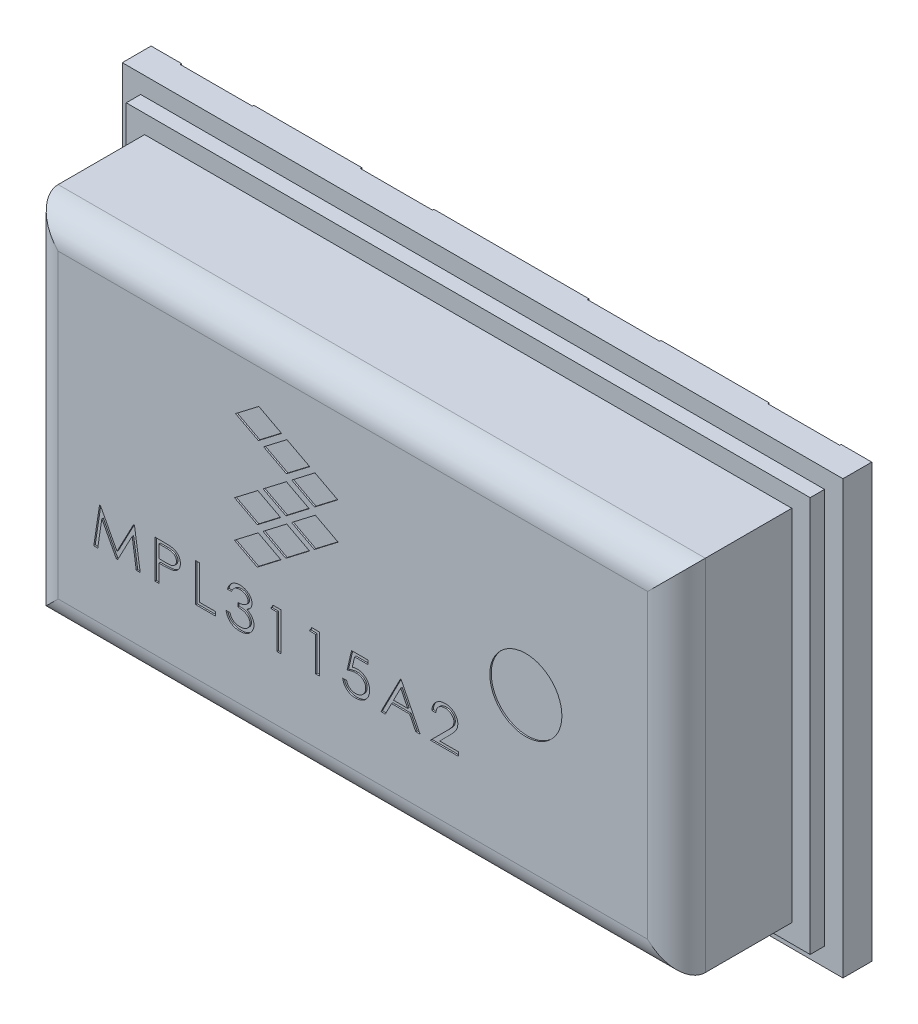
from build123d import *

# Parameters (mm, degrees)
ESQUISSE1_W                = 5
ESQUISSE1_H                = 3
BOSS_EXTRU_1_DEPTH         = 1.1
ESQUISSE2_W                = 5.463986024
ESQUISSE2_H                = 3.314690822
ESQUISSE2_W_2              = 4.49
ESQUISSE2_H_2              = 2.49
ENL_V_MAT_EXTRU_1_DEPTH    = 0.8
ESQUISSE3_W                = 6.113321587
ESQUISSE3_H                = 3.858847251
ESQUISSE3_W_2              = 4.745
ESQUISSE3_H_2              = 2.745
ENL_V_MAT_EXTRU_2_DEPTH    = 0.1
CONG_1_R                   = 0.2
ESQUISSE4_R                = 0.25
ENL_V_MAT_EXTRU_3_DEPTH    = 0.01
ENL_V_MAT_EXTRU_4_DEPTH    = 0.01
R_P_TITION_LIN_AIRE5_COUNT = 3
R_P_TITION_LIN_AIRE5_PITCH = 0.22
R_P_TITION_LIN_AIRE6_COUNT = 3
R_P_TITION_LIN_AIRE6_PITCH = 0.25
ENL_V_MAT_EXTRU_6_DEPTH    = 0.01
R_P_TITION_LIN_AIRE7_COUNT = 3
R_P_TITION_LIN_AIRE7_PITCH = 0.25
ESQUISSE11_W               = 0.5
ESQUISSE11_H               = 0.8
ENL_V_MAT_EXTRU_7_DEPTH    = 0.01


with BuildPart() as part:
    # Esquisse1 → Boss.-Extru.1 (new body)
    with BuildSketch(Plane.XY):
        Rectangle(ESQUISSE1_W, ESQUISSE1_H)
    extrude(amount=BOSS_EXTRU_1_DEPTH)

    # Esquisse2 → Enlèv. mat.-Extru.1 (cut)
    with BuildSketch(Plane.XY.offset(1.1)):
        with Locations((-0.041855809, -0.006906267)):
            Rectangle(ESQUISSE2_W, ESQUISSE2_H)
        Rectangle(ESQUISSE2_W_2, ESQUISSE2_H_2, mode=Mode.SUBTRACT)
    extrude(amount=-ENL_V_MAT_EXTRU_1_DEPTH, mode=Mode.SUBTRACT)

    # Esquisse3 → Enlèv. mat.-Extru.2 (cut)
    with BuildSketch(Plane.XY.offset(0.3)):
        with Locations((-0.001557514, -0.062098825)):
            Rectangle(ESQUISSE3_W, ESQUISSE3_H)
        Rectangle(ESQUISSE3_W_2, ESQUISSE3_H_2, mode=Mode.SUBTRACT)
    extrude(amount=-ENL_V_MAT_EXTRU_2_DEPTH, mode=Mode.SUBTRACT)

    # Congé1
    cong_1_edges = [part.edges().sort_by_distance(p)[0] for p in [
        (0, -1.245, 1.1),
        (-2.245, 0, 1.1),
        (0, 1.245, 1.1),
        (2.245, 0, 1.1),
    ]]
    fillet(cong_1_edges, radius=CONG_1_R)

    # Esquisse4 → Enlèv. mat.-Extru.3 (cut)
    # profile 1 of 10: a face of its own
    with BuildSketch(Plane.XY.offset(1.1)):
        with Locations((1.2, 0)):
            Circle(ESQUISSE4_R)
    # profile 2 of 10: a face of its own
    with BuildSketch(Plane.XY.offset(1.1)):
        Polygon((-1.797798583, -0.601831467), (-1.75799448, -0.337248134), (-1.751369296, -0.337248134), (-1.636674117, -0.554342151), (-1.522137943, -0.337248134), (-1.515459758, -0.337248134), (-1.475549651, -0.601831467), (-1.502845408, -0.601831467), (-1.531519203, -0.411874202), (-1.631691979, -0.601831467), (-1.641444249, -0.601831467), (-1.741829032, -0.411874202), (-1.770396824, -0.601831467), align=None)
    # profile 3 of 10: a face of its own
    with BuildSketch(Plane.XY.offset(1.1)):
        with BuildLine():
            Line((-1.373108412, -0.337248134), (-1.316873853, -0.337248134))
            add(Edge.make_bspline(
                [(-1.316873853, -0.337248134), (-1.3130046, -0.337251925), (-1.305601112, -0.337259178), (-1.294982671, -0.337488225), (-1.285352454, -0.337790167), (-1.276694885, -0.338217738), (-1.269019689, -0.338707253), (-1.26234247, -0.339413279), (-1.256633218, -0.340143325), (-1.253197795, -0.340884702), (-1.251629045, -0.341223244)],
                knots=[0, 0, 0, 0, 1.418409831, 2.714006813, 3.893404716, 4.950375869, 5.891726568, 6.712121466, 7.411903736, 8, 8, 8, 8], degree=3))
            add(Edge.make_bspline(
                [(-1.251629045, -0.341223244), (-1.249641242, -0.341722051), (-1.245728663, -0.34270385), (-1.240083872, -0.344697394), (-1.234711534, -0.347025506), (-1.229608893, -0.349739154), (-1.224774794, -0.352804629), (-1.220248833, -0.356278647), (-1.215997178, -0.360107791), (-1.212030097, -0.364277515), (-1.208426322, -0.368765797), (-1.205264653, -0.37356569), (-1.202641967, -0.378660228), (-1.200400291, -0.38401101), (-1.198827903, -0.389687061), (-1.197553794, -0.395607612), (-1.196897387, -0.401824628), (-1.196779529, -0.406060475), (-1.196719523, -0.408217101)],
                knots=[0, 0, 0, 0, 1.044614879, 2.05610904, 3.048648156, 4.028015397, 5.000229019, 5.96426823, 6.933932136, 7.915327783, 8.896020172, 9.865558509, 10.840731438, 11.814446678, 12.818086411, 13.839363335, 14.899940407, 16, 16, 16, 16], degree=3))
            add(Edge.make_bspline(
                [(-1.196719523, -0.408217101), (-1.196747747, -0.41039286), (-1.196802996, -0.414651907), (-1.197603517, -0.420883198), (-1.198728552, -0.42683236), (-1.200391276, -0.432489355), (-1.202499861, -0.437857794), (-1.205126142, -0.442926068), (-1.208194553, -0.447715625), (-1.211768459, -0.452154112), (-1.215701558, -0.456304534), (-1.219998139, -0.460133147), (-1.224684125, -0.463588348), (-1.229729069, -0.466658186), (-1.235124966, -0.469367651), (-1.240856021, -0.471761708), (-1.246975476, -0.473776664), (-1.251215243, -0.474831734), (-1.253378094, -0.475369962)],
                knots=[0, 0, 0, 0, 1.088161205, 2.130074408, 3.139321425, 4.115850349, 5.076395988, 6.021556806, 6.968288003, 7.918357923, 8.869044838, 9.827308699, 10.794667379, 11.778852344, 12.779307233, 13.813840501, 14.884765, 16, 16, 16, 16], degree=3))
            add(Edge.make_bspline(
                [(-1.253378094, -0.475369962), (-1.255159605, -0.475722257), (-1.259059213, -0.476493406), (-1.265482287, -0.477360927), (-1.272943175, -0.478089083), (-1.281464262, -0.478649666), (-1.291023728, -0.479116614), (-1.301642212, -0.479493521), (-1.31330425, -0.479699735), (-1.321431901, -0.479710478), (-1.325672097, -0.479716083)],
                knots=[0, 0, 0, 0, 0.60082097, 1.315155928, 2.143520297, 3.081116683, 4.140582134, 5.31053358, 6.59690521, 8, 8, 8, 8], degree=3))
            Line((-1.325672097, -0.479716083), (-1.34597166, -0.479716083))
            Line((-1.34597166, -0.479716083), (-1.34597166, -0.601831467))
            Line((-1.34597166, -0.601831467), (-1.373108412, -0.601831467))
            Line((-1.373108412, -0.601831467), (-1.373108412, -0.337248134))
        make_face()
        with BuildLine():
            Line((-1.34597166, -0.364384886), (-1.34597166, -0.452579331))
            Line((-1.34597166, -0.452579331), (-1.296945301, -0.453162347))
            add(Edge.make_bspline(
                [(-1.296945301, -0.453162347), (-1.29454218, -0.453163595), (-1.289910946, -0.453166002), (-1.283232555, -0.452865269), (-1.277045261, -0.452516565), (-1.271350149, -0.452003686), (-1.266157975, -0.451297528), (-1.261454264, -0.450550354), (-1.257273768, -0.449515799), (-1.252378318, -0.448097108), (-1.246927845, -0.445697726), (-1.241009962, -0.442179503), (-1.235940501, -0.437752553), (-1.231614451, -0.432710384), (-1.228201742, -0.427109156), (-1.225644032, -0.421144762), (-1.224115281, -0.414830468), (-1.223943092, -0.410504324), (-1.223856275, -0.408323104)],
                knots=[0, 0, 0, 0, 1.187936968, 2.289362064, 3.304418159, 4.251789532, 5.115278311, 5.895009063, 6.604718384, 7.243061292, 8.41291016, 9.537911015, 10.634059128, 11.724519996, 12.810599303, 13.863471255, 14.922772688, 16, 16, 16, 16], degree=3))
            add(Edge.make_bspline(
                [(-1.223856275, -0.408323104), (-1.223943695, -0.406194588), (-1.224117804, -0.401955343), (-1.225655832, -0.395751125), (-1.228197092, -0.389849123), (-1.231636453, -0.384319973), (-1.235839654, -0.379289506), (-1.240793678, -0.375004703), (-1.246345239, -0.371460221), (-1.251543234, -0.369237391), (-1.256158645, -0.367865891), (-1.260152518, -0.366902688), (-1.264667881, -0.366121906), (-1.269694688, -0.365514969), (-1.275224068, -0.364968896), (-1.281270556, -0.364614703), (-1.287845095, -0.364400087), (-1.292404657, -0.364390081), (-1.294772241, -0.364384886)],
                knots=[0, 0, 0, 0, 1.079672715, 2.15032351, 3.223565093, 4.331534505, 5.445842985, 6.539700356, 7.644832641, 8.778158669, 9.396906618, 10.088920543, 10.863330602, 11.722450615, 12.659849889, 13.684592725, 14.7977086, 16, 16, 16, 16], degree=3))
            Line((-1.294772241, -0.364384886), (-1.34597166, -0.364384886))
        make_face(mode=Mode.SUBTRACT)
    # profile 4 of 10: a face of its own
    with BuildSketch(Plane.XY.offset(1.1)):
        Polygon((-1.09088619, -0.337248134), (-1.063749438, -0.337248134), (-1.063749438, -0.574694715), (-0.951810335, -0.574694715), (-0.951810335, -0.601831467), (-1.09088619, -0.601831467), align=None)
    # profile 5 of 10: a face of its own
    with BuildSketch(Plane.XY.offset(1.1)):
        with BuildLine():
            Line((-0.842584908, -0.398305826), (-0.86972166, -0.398305826))
            add(Edge.make_bspline(
                [(-0.86972166, -0.398305826), (-0.869006615, -0.3956417), (-0.86760721, -0.390427776), (-0.86478685, -0.382976449), (-0.861640495, -0.375950976), (-0.857966898, -0.369407738), (-0.853829011, -0.363330436), (-0.849175938, -0.3577628), (-0.844162711, -0.352575024), (-0.838609527, -0.347988286), (-0.832759805, -0.343848355), (-0.826572942, -0.340290912), (-0.820138274, -0.337260648), (-0.813445319, -0.334749326), (-0.806466528, -0.332851529), (-0.799253807, -0.331487859), (-0.791778914, -0.330593257), (-0.786706314, -0.330507565), (-0.784124287, -0.330463946)],
                knots=[0, 0, 0, 0, 1.116355944, 2.184804219, 3.222141051, 4.231113984, 5.219328683, 6.194876446, 7.166217883, 8.136267484, 9.106844572, 10.065215996, 11.022117626, 11.98422021, 12.956167426, 13.946761748, 14.954871942, 16, 16, 16, 16], degree=3))
            add(Edge.make_bspline(
                [(-0.784124287, -0.330463946), (-0.780371292, -0.330568638), (-0.772944587, -0.330775809), (-0.76202922, -0.332650589), (-0.751504679, -0.335623305), (-0.74149577, -0.339738076), (-0.732205694, -0.344821722), (-0.723897707, -0.350819184), (-0.716787704, -0.357747609), (-0.710787417, -0.365343794), (-0.706095421, -0.373493279), (-0.702637747, -0.381874098), (-0.700525403, -0.390481646), (-0.700253125, -0.396298073), (-0.700116959, -0.399206851)],
                knots=[0, 0, 0, 0, 1.123321227, 2.222910833, 3.306649022, 4.393470362, 5.456864647, 6.471880394, 7.452320752, 8.420908763, 9.362108778, 10.259259549, 11.129460877, 12, 12, 12, 12], degree=3))
            add(Edge.make_bspline(
                [(-0.700116959, -0.399206851), (-0.700208754, -0.402007081), (-0.700388791, -0.407499195), (-0.702108251, -0.41549247), (-0.704823686, -0.423040134), (-0.708613704, -0.430168839), (-0.713579838, -0.436778554), (-0.719565438, -0.442970861), (-0.72667745, -0.448667841), (-0.731985917, -0.45194646), (-0.734726918, -0.45363936)],
                knots=[0, 0, 0, 0, 0.989635591, 1.940980818, 2.878257013, 3.820688598, 4.785857322, 5.793802215, 6.860840457, 8, 8, 8, 8], degree=3))
            add(Edge.make_bspline(
                [(-0.734726918, -0.45363936), (-0.731663382, -0.454989961), (-0.725644408, -0.457643507), (-0.717434709, -0.46296832), (-0.709947721, -0.469016012), (-0.705758716, -0.473820266), (-0.703668057, -0.476217986)],
                knots=[0, 0, 0, 0, 1.034096765, 2.031705015, 3.017658317, 4, 4, 4, 4], degree=3))
            add(Edge.make_bspline(
                [(-0.703668057, -0.476217986), (-0.702287164, -0.477957844), (-0.699557927, -0.481396548), (-0.696174344, -0.486962613), (-0.69312006, -0.49257785), (-0.690791466, -0.49843813), (-0.68882182, -0.504384765), (-0.687520215, -0.510535301), (-0.686699142, -0.516829962), (-0.68659893, -0.521090003), (-0.686548583, -0.523230289)],
                knots=[0, 0, 0, 0, 1.043047349, 2.06150724, 3.057059767, 4.044020338, 5.020973223, 5.99827899, 6.994316291, 8, 8, 8, 8], degree=3))
            add(Edge.make_bspline(
                [(-0.686548583, -0.523230289), (-0.686593756, -0.525086732), (-0.686683889, -0.528790855), (-0.687275673, -0.534320512), (-0.688276305, -0.539779925), (-0.68972898, -0.545180017), (-0.691586187, -0.550504223), (-0.693799866, -0.555781277), (-0.696506985, -0.560932868), (-0.699467729, -0.566052129), (-0.702870475, -0.570949959), (-0.706532532, -0.575637524), (-0.710480438, -0.58005286), (-0.714840912, -0.584063863), (-0.719368965, -0.587921526), (-0.724278463, -0.591391661), (-0.729418652, -0.594660222), (-0.734875178, -0.597544951), (-0.740554156, -0.600150447), (-0.7464122, -0.602416809), (-0.752441992, -0.604352119), (-0.758631688, -0.605857536), (-0.764979593, -0.607092841), (-0.771488908, -0.607992632), (-0.778178676, -0.6085375), (-0.782692224, -0.608589425), (-0.784972311, -0.608615655)],
                knots=[0, 0, 0, 0, 0.92169803, 1.839044851, 2.757774576, 3.674827786, 4.612457936, 5.555774093, 6.513016878, 7.499902905, 8.490174619, 9.47107816, 10.452334622, 11.426626846, 12.410467524, 13.403648671, 14.408766131, 15.432992845, 16.465300959, 17.509466555, 18.549756312, 19.60710264, 20.67025462, 21.759431652, 22.868142969, 24, 24, 24, 24], degree=3))
            add(Edge.make_bspline(
                [(-0.784972311, -0.608615655), (-0.788030659, -0.60855108), (-0.794019609, -0.608424628), (-0.802817185, -0.607535485), (-0.811194557, -0.60593403), (-0.819201041, -0.603744707), (-0.826848151, -0.60101881), (-0.834098341, -0.597595439), (-0.840958353, -0.5935673), (-0.847379539, -0.588892637), (-0.853337357, -0.583618044), (-0.858822051, -0.577791209), (-0.863713953, -0.571324768), (-0.868049726, -0.564303304), (-0.871919872, -0.556737041), (-0.875081483, -0.548538239), (-0.877921013, -0.539819187), (-0.879228261, -0.533721325), (-0.879897942, -0.530597493)],
                knots=[0, 0, 0, 0, 1.089030947, 2.132572979, 3.144340947, 4.122636792, 5.085826611, 6.031433048, 6.973369982, 7.914634373, 8.855057411, 9.803109251, 10.759391439, 11.737019511, 12.738643989, 13.780724783, 14.863102731, 16, 16, 16, 16], degree=3))
            Line((-0.879897942, -0.530597493), (-0.85276119, -0.530597493))
            add(Edge.make_bspline(
                [(-0.85276119, -0.530597493), (-0.85210785, -0.532635276), (-0.850836393, -0.536600983), (-0.848676627, -0.542302663), (-0.846248642, -0.547545594), (-0.843579987, -0.552327599), (-0.840778763, -0.556707114), (-0.837748016, -0.560659786), (-0.834486833, -0.564167429), (-0.832093515, -0.566183721), (-0.830924585, -0.567168507)],
                knots=[0, 0, 0, 0, 1.187591516, 2.311159086, 3.381569441, 4.391100686, 5.348474685, 6.26437783, 7.152297666, 8, 8, 8, 8], degree=3))
            add(Edge.make_bspline(
                [(-0.830924585, -0.567168507), (-0.829371654, -0.568310554), (-0.826267689, -0.570593256), (-0.821224991, -0.573517174), (-0.815899138, -0.57602271), (-0.810193813, -0.577960013), (-0.804235368, -0.579572223), (-0.797935491, -0.580654488), (-0.791349554, -0.581379736), (-0.786847092, -0.581445385), (-0.784548299, -0.581478903)],
                knots=[0, 0, 0, 0, 0.934841818, 1.868542889, 2.823608252, 3.786147903, 4.788489089, 5.816032122, 6.884945635, 8, 8, 8, 8], degree=3))
            add(Edge.make_bspline(
                [(-0.784548299, -0.581478903), (-0.781931061, -0.581432626), (-0.776825307, -0.581342348), (-0.769390125, -0.580506948), (-0.762334556, -0.579286767), (-0.755704286, -0.577386373), (-0.749402314, -0.575105225), (-0.743562893, -0.572133497), (-0.738060154, -0.568764084), (-0.733053918, -0.564825936), (-0.728532992, -0.56058302), (-0.724583952, -0.556104007), (-0.721203445, -0.551468964), (-0.718435472, -0.546640597), (-0.716276604, -0.541611887), (-0.714814412, -0.536386747), (-0.713874081, -0.531002197), (-0.713748605, -0.527350624), (-0.713685335, -0.525509352)],
                knots=[0, 0, 0, 0, 1.249364874, 2.437282909, 3.569203944, 4.664369636, 5.726875827, 6.764470109, 7.787556699, 8.80352195, 9.800248248, 10.744722387, 11.650966389, 12.535226244, 13.397106462, 14.257002303, 15.1211095, 16, 16, 16, 16], degree=3))
            add(Edge.make_bspline(
                [(-0.713685335, -0.525509352), (-0.713791782, -0.523042068), (-0.714004508, -0.518111372), (-0.715913271, -0.510884658), (-0.718901856, -0.503898878), (-0.723130477, -0.49731157), (-0.72827959, -0.491196756), (-0.734317174, -0.485789435), (-0.74120202, -0.481249284), (-0.747583315, -0.478157759), (-0.75324495, -0.476068049), (-0.758074165, -0.474633345), (-0.763469093, -0.47345191), (-0.769403318, -0.472324339), (-0.775895726, -0.471395602), (-0.78292993, -0.470598811), (-0.790512578, -0.469963847), (-0.795766036, -0.469684514), (-0.798487686, -0.469539801)],
                knots=[0, 0, 0, 0, 1.042984283, 2.08433108, 3.143128335, 4.249222157, 5.385113909, 6.51878688, 7.668120448, 8.865777362, 9.511886398, 10.22190494, 10.99673624, 11.849106467, 12.778958184, 13.77268577, 14.846099398, 16, 16, 16, 16], degree=3))
            Line((-0.798487686, -0.469539801), (-0.798487686, -0.442403049))
            add(Edge.make_bspline(
                [(-0.798487686, -0.442403049), (-0.79505554, -0.442347421), (-0.788327419, -0.442238372), (-0.778486075, -0.44092081), (-0.769072042, -0.439109263), (-0.760299472, -0.436321209), (-0.752322467, -0.433081651), (-0.745402792, -0.429317936), (-0.739633844, -0.425134348), (-0.735041532, -0.420463422), (-0.731577769, -0.415449519), (-0.7290796, -0.410211647), (-0.727511654, -0.404738624), (-0.727339856, -0.400983694), (-0.727253711, -0.399100848)],
                knots=[0, 0, 0, 0, 1.341656069, 2.630081648, 3.878419675, 5.087257311, 6.224426624, 7.242095775, 8.16131872, 9.001938776, 9.791789743, 10.533744472, 11.264771053, 12, 12, 12, 12], degree=3))
            add(Edge.make_bspline(
                [(-0.727253711, -0.399100848), (-0.727308423, -0.397719681), (-0.72741723, -0.394972921), (-0.72817189, -0.390945693), (-0.729419948, -0.387049048), (-0.731148858, -0.38328783), (-0.733491765, -0.379716126), (-0.736248841, -0.376262552), (-0.739509556, -0.37294949), (-0.743272041, -0.369874942), (-0.7473426, -0.366956531), (-0.751781888, -0.364469208), (-0.756463193, -0.362344159), (-0.761403307, -0.360579499), (-0.766626725, -0.359271615), (-0.772100591, -0.358322112), (-0.777839499, -0.35772779), (-0.781755444, -0.357643633), (-0.783753277, -0.357600698)],
                knots=[0, 0, 0, 0, 0.853648546, 1.697670886, 2.523188139, 3.378302657, 4.247803805, 5.156940784, 6.106885888, 7.11512794, 8.157515917, 9.199274311, 10.255022773, 11.332799812, 12.437414037, 13.579407759, 14.765064121, 16, 16, 16, 16], degree=3))
            add(Edge.make_bspline(
                [(-0.783753277, -0.357600698), (-0.786960208, -0.357703243), (-0.793195032, -0.357902607), (-0.802196601, -0.359723623), (-0.810569402, -0.362551285), (-0.816982583, -0.366000738), (-0.821718104, -0.369388594), (-0.825116206, -0.372322142), (-0.828392408, -0.375642374), (-0.831483213, -0.37941752), (-0.834512532, -0.38354433), (-0.837384122, -0.388075121), (-0.840087771, -0.393025184), (-0.841736936, -0.396512639), (-0.842584908, -0.398305826)],
                knots=[0, 0, 0, 0, 1.509259838, 2.934260404, 4.308252053, 5.660031487, 6.34601821, 7.048371135, 7.772289125, 8.540633061, 9.344706165, 10.182863007, 11.065660648, 12, 12, 12, 12], degree=3))
        make_face()
    # profile 6 of 10: a face of its own
    with BuildSketch(Plane.XY.offset(1.1)):
        Polygon((-0.553737502, -0.337248134), (-0.499304993, -0.337248134), (-0.499304993, -0.601831467), (-0.526441745, -0.601831467), (-0.526441745, -0.364384886), (-0.570538968, -0.364384886), align=None)
    # profile 7 of 10: a face of its own
    with BuildSketch(Plane.XY.offset(1.1)):
        Polygon((-0.285083656, -0.337248134), (-0.230651147, -0.337248134), (-0.230651147, -0.601831467), (-0.257787899, -0.601831467), (-0.257787899, -0.364384886), (-0.301885121, -0.364384886), align=None)
    # profile 8 of 10: a face of its own
    with BuildSketch(Plane.XY.offset(1.1)):
        with BuildLine():
            Line((0.105844579, -0.337248134), (0.105844579, -0.364384886))
            Line((0.105844579, -0.364384886), (0.012031979, -0.364384886))
            Line((0.012031979, -0.364384886), (-0.004133469, -0.434293824))
            add(Edge.make_bspline(
                [(-0.004133469, -0.434293824), (-0.00119348, -0.433455453), (0.004503451, -0.43183091), (0.012943185, -0.430181618), (0.02092085, -0.429005658), (0.026108796, -0.428890464), (0.028621439, -0.428834672)],
                knots=[0, 0, 0, 0, 1.100584957, 2.132646227, 3.095596962, 4, 4, 4, 4], degree=3))
            add(Edge.make_bspline(
                [(0.028621439, -0.428834672), (0.031717069, -0.428899029), (0.037807482, -0.429025647), (0.046713051, -0.430226793), (0.055213117, -0.432132152), (0.063292876, -0.43478592), (0.070985428, -0.438176663), (0.078219163, -0.442420341), (0.085098485, -0.447336169), (0.091415763, -0.453068793), (0.097154529, -0.459338888), (0.102268198, -0.466040154), (0.106477776, -0.473241201), (0.110059831, -0.480801994), (0.112651734, -0.488875215), (0.114643127, -0.497321305), (0.115827789, -0.506218602), (0.115955673, -0.512290796), (0.116020861, -0.515386071)],
                knots=[0, 0, 0, 0, 1.077151714, 2.119212705, 3.121851832, 4.105966215, 5.075130764, 6.042439667, 7.020500988, 8.01341629, 9.005912455, 9.976422566, 10.941539175, 11.904595977, 12.882869982, 13.886885156, 14.922848286, 16, 16, 16, 16], degree=3))
            add(Edge.make_bspline(
                [(0.116020861, -0.515386071), (0.11597562, -0.517542607), (0.115885715, -0.521828076), (0.115303453, -0.528187508), (0.114289902, -0.534420065), (0.112868288, -0.540516685), (0.110993704, -0.546456167), (0.108770793, -0.552274504), (0.106093296, -0.557938695), (0.103115827, -0.563490381), (0.099712262, -0.568760426), (0.096061369, -0.573777769), (0.092069715, -0.578432785), (0.087824404, -0.582812185), (0.083252971, -0.586828904), (0.078415282, -0.59056719), (0.073266403, -0.59394935), (0.067846533, -0.59702336), (0.062200198, -0.599796625), (0.056277405, -0.602103999), (0.050198015, -0.604127949), (0.043881238, -0.605789623), (0.037344933, -0.60704505), (0.030582544, -0.60792374), (0.023633606, -0.608556962), (0.01892365, -0.608595917), (0.016537104, -0.608615655)],
                knots=[0, 0, 0, 0, 1.016499425, 2.019987615, 3.007067189, 3.990768755, 4.967927679, 5.940676635, 6.924201944, 7.919118939, 8.907813052, 9.878849546, 10.841710254, 11.795707484, 12.751447708, 13.707514388, 14.675260193, 15.652383633, 16.643074722, 17.637399078, 18.645988148, 19.661975783, 20.713747707, 21.780771562, 22.875511604, 24, 24, 24, 24], degree=3))
            add(Edge.make_bspline(
                [(0.016537104, -0.608615655), (0.013689105, -0.608563543), (0.00809818, -0.608461242), (-8.37e-05, -0.607391812), (-0.007952936, -0.605837556), (-0.015469587, -0.603542444), (-0.022678924, -0.600642744), (-0.029471078, -0.596982613), (-0.035998141, -0.592796589), (-0.042099723, -0.587925765), (-0.047754839, -0.582562747), (-0.052796595, -0.576723818), (-0.057371298, -0.570601193), (-0.061132694, -0.563961824), (-0.06449473, -0.557056618), (-0.06710373, -0.54970294), (-0.069211548, -0.541998233), (-0.070095795, -0.536684736), (-0.070544309, -0.533989587)],
                knots=[0, 0, 0, 0, 1.085877747, 2.131692758, 3.142880474, 4.14286505, 5.125366391, 6.102257235, 7.081864604, 8.079734589, 9.076078377, 10.05059479, 11.019852918, 11.986271429, 12.957004748, 13.94627934, 14.958297804, 16, 16, 16, 16], degree=3))
            Line((-0.070544309, -0.533989587), (-0.043407557, -0.533989587))
            add(Edge.make_bspline(
                [(-0.043407557, -0.533989587), (-0.042787468, -0.536513183), (-0.041594654, -0.541367609), (-0.039030091, -0.548193565), (-0.035853535, -0.554272524), (-0.032045216, -0.55966514), (-0.027556767, -0.564396131), (-0.022407239, -0.568596654), (-0.016626604, -0.572371531), (-0.01022488, -0.575550598), (-0.003467567, -0.578220704), (0.003603497, -0.580042901), (0.010804613, -0.581283543), (0.01568389, -0.581413719), (0.018127148, -0.581478903)],
                knots=[0, 0, 0, 0, 1.105255689, 2.126085831, 3.094714204, 4.016847766, 4.926388513, 5.861187163, 6.839282794, 7.858145028, 8.898395173, 9.925188997, 10.961054995, 12, 12, 12, 12], degree=3))
            add(Edge.make_bspline(
                [(0.018127148, -0.581478903), (0.02051542, -0.581417455), (0.025203279, -0.581296841), (0.032100119, -0.580354283), (0.038751777, -0.578906838), (0.045116524, -0.576740395), (0.051294741, -0.574108169), (0.057138111, -0.57074328), (0.062772606, -0.566840494), (0.068054477, -0.562380741), (0.072921994, -0.557487873), (0.077192272, -0.552217493), (0.080801499, -0.546631102), (0.083811423, -0.540769875), (0.086098923, -0.534592799), (0.08765853, -0.528112984), (0.088729242, -0.521357639), (0.088831869, -0.516733072), (0.088884109, -0.514379043)],
                knots=[0, 0, 0, 0, 1.055051283, 2.070925109, 3.071045655, 4.058623374, 5.037677312, 6.034164763, 7.032607791, 8.063255273, 9.08460474, 10.078366321, 11.055051477, 12.018762383, 12.984653025, 13.957962099, 14.960548061, 16, 16, 16, 16], degree=3))
            add(Edge.make_bspline(
                [(0.088884109, -0.514379043), (0.088845774, -0.512255112), (0.088770649, -0.508092902), (0.087811476, -0.502027756), (0.086411415, -0.49626144), (0.084372564, -0.490804968), (0.081762023, -0.485661389), (0.078627814, -0.480773191), (0.074825458, -0.476280671), (0.07052969, -0.472092143), (0.065787434, -0.468288899), (0.060609236, -0.464961612), (0.054994193, -0.462243638), (0.049068689, -0.459858277), (0.042707197, -0.45815392), (0.035997531, -0.456860219), (0.028884788, -0.456131574), (0.024011874, -0.456025622), (0.021519242, -0.455971425)],
                knots=[0, 0, 0, 0, 1.015670352, 1.990380851, 2.931800134, 3.852286557, 4.771295661, 5.688435274, 6.625018434, 7.581846215, 8.556520028, 9.530055911, 10.520920521, 11.538525318, 12.582836159, 13.667522609, 14.806872476, 16, 16, 16, 16], degree=3))
            add(Edge.make_bspline(
                [(0.021519242, -0.455971425), (0.019344736, -0.456014287), (0.014881013, -0.456102274), (0.008016616, -0.45678091), (0.000817645, -0.457839772), (-0.006715023, -0.459336156), (-0.014579535, -0.46126143), (-0.022781787, -0.463596947), (-0.031322457, -0.46634946), (-0.037072114, -0.468459589), (-0.040015463, -0.469539801)],
                knots=[0, 0, 0, 0, 0.823935763, 1.691335702, 2.611665863, 3.580679742, 4.600450859, 5.679197418, 6.811940615, 8, 8, 8, 8], degree=3))
            Line((-0.040015463, -0.469539801), (-0.009486617, -0.337248134))
            Line((-0.009486617, -0.337248134), (0.105844579, -0.337248134))
        make_face()
    # profile 9 of 10: a face of its own
    with BuildSketch(Plane.XY.offset(1.1)):
        Polygon((0.333793297, -0.337248134), (0.466084964, -0.601831467), (0.436192135, -0.601831467), (0.39379096, -0.517029117), (0.268177479, -0.517029117), (0.224716274, -0.601831467), (0.194717443, -0.601831467), (0.330401203, -0.337248134), align=None)
        Polygon((0.331779242, -0.393005679), (0.282116865, -0.489892365), (0.380275586, -0.489892365), align=None, mode=Mode.SUBTRACT)
    # profile 10 of 10: a face of its own
    with BuildSketch(Plane.XY.offset(1.1)):
        with BuildLine():
            Line((0.575310391, -0.41865839), (0.548173639, -0.41865839))
            add(Edge.make_bspline(
                [(0.548173639, -0.41865839), (0.54834398, -0.415507965), (0.548678761, -0.409316268), (0.550186753, -0.400279926), (0.552479091, -0.391673879), (0.555533644, -0.383487348), (0.559468355, -0.375760713), (0.564055387, -0.368389103), (0.56958075, -0.361534923), (0.575808371, -0.355164496), (0.582592935, -0.349366977), (0.589837915, -0.344280001), (0.597514292, -0.340045737), (0.605539967, -0.336514005), (0.613983123, -0.333812617), (0.622796894, -0.331853719), (0.632024195, -0.330654908), (0.638307829, -0.3305284), (0.641509226, -0.330463946)],
                knots=[0, 0, 0, 0, 1.058365535, 2.080061621, 3.068269832, 4.044123835, 5.006807913, 5.974210925, 6.953123194, 7.955376811, 8.960713323, 9.944481168, 10.921343657, 11.898584061, 12.883138005, 13.891687467, 14.925853214, 16, 16, 16, 16], degree=3))
            add(Edge.make_bspline(
                [(0.641509226, -0.330463946), (0.644657345, -0.330531857), (0.650815069, -0.330664691), (0.659827618, -0.331802951), (0.668373067, -0.333657981), (0.676493745, -0.336177132), (0.684111372, -0.339539625), (0.691241765, -0.343665628), (0.697989778, -0.348430339), (0.704110007, -0.354005485), (0.70969082, -0.35997165), (0.714563041, -0.366293988), (0.718731814, -0.372853536), (0.722063604, -0.379755644), (0.724753591, -0.386855118), (0.726601153, -0.394254874), (0.727748424, -0.401909048), (0.727885325, -0.407117659), (0.727954622, -0.409754144)],
                knots=[0, 0, 0, 0, 1.153801189, 2.256836437, 3.323993489, 4.356423587, 5.368539985, 6.369549116, 7.372463318, 8.390695778, 9.398949994, 10.364113306, 11.312947386, 12.242800634, 13.16917339, 14.091302172, 15.033859197, 16, 16, 16, 16], degree=3))
            add(Edge.make_bspline(
                [(0.727954622, -0.409754144), (0.727810655, -0.4134575), (0.727524349, -0.420822322), (0.725258151, -0.431660915), (0.721650974, -0.442156328), (0.717319197, -0.450573627), (0.713026888, -0.457373746), (0.709070215, -0.462941483), (0.704457834, -0.468955878), (0.699206965, -0.475453759), (0.693197379, -0.482300275), (0.6865572, -0.489652947), (0.679200715, -0.497406276), (0.674024303, -0.502690715), (0.671349053, -0.505421795)],
                knots=[0, 0, 0, 0, 1.165482123, 2.3177811, 3.472093297, 4.651569522, 5.289127253, 6.003857704, 6.801763299, 7.675949041, 8.634330951, 9.670326313, 10.795988365, 12, 12, 12, 12], degree=3))
            Line((0.671349053, -0.505421795), (0.602076133, -0.574694715))
            Line((0.602076133, -0.574694715), (0.731346716, -0.574694715))
            Line((0.731346716, -0.574694715), (0.731346716, -0.601831467))
            Line((0.731346716, -0.601831467), (0.537997357, -0.601831467))
            Line((0.537997357, -0.601831467), (0.647445391, -0.492330432))
            add(Edge.make_bspline(
                [(0.647445391, -0.492330432), (0.650099441, -0.489719776), (0.65520266, -0.484699994), (0.662469663, -0.477424442), (0.66893919, -0.4706075), (0.67474204, -0.46435756), (0.679809464, -0.458624496), (0.684143682, -0.453394946), (0.687755917, -0.448707509), (0.691554823, -0.443187029), (0.695278129, -0.436490056), (0.69851118, -0.428288931), (0.70044273, -0.419825313), (0.700692414, -0.41410993), (0.70081787, -0.411238185)],
                knots=[0, 0, 0, 0, 1.343082261, 2.582484091, 3.709530028, 4.733396915, 5.659164388, 6.469527046, 7.183409814, 7.793323211, 8.885980508, 9.939397012, 10.964631844, 12, 12, 12, 12], degree=3))
            add(Edge.make_bspline(
                [(0.70081787, -0.411238185), (0.700773352, -0.409432513), (0.700685547, -0.405871119), (0.699796252, -0.400647995), (0.698412823, -0.395621584), (0.696496184, -0.390759965), (0.694006299, -0.386100663), (0.690932351, -0.381667904), (0.687360215, -0.377398757), (0.683271249, -0.373378756), (0.678788899, -0.369683297), (0.674014338, -0.366422736), (0.668950547, -0.363729293), (0.663669539, -0.361483034), (0.658138335, -0.359715393), (0.652344061, -0.358526998), (0.646317688, -0.357755216), (0.642218342, -0.357652828), (0.640131188, -0.357600698)],
                knots=[0, 0, 0, 0, 0.962340989, 1.89806141, 2.817120788, 3.739315004, 4.679437949, 5.628257868, 6.611593212, 7.64443402, 8.682078366, 9.706632143, 10.722700226, 11.73609922, 12.764286792, 13.814055302, 14.887040945, 16, 16, 16, 16], degree=3))
            add(Edge.make_bspline(
                [(0.640131188, -0.357600698), (0.637938502, -0.357654279), (0.633646298, -0.357759164), (0.627346237, -0.358503439), (0.621338894, -0.359786023), (0.615604172, -0.361525243), (0.61014684, -0.363762167), (0.604977691, -0.366531941), (0.600098379, -0.369843605), (0.595497844, -0.373578091), (0.591286664, -0.377771961), (0.587566868, -0.382429694), (0.584265543, -0.387452253), (0.58150166, -0.392918086), (0.579211848, -0.398775821), (0.577450773, -0.405050741), (0.576012332, -0.411699377), (0.575548088, -0.416301874), (0.575310391, -0.41865839)],
                knots=[0, 0, 0, 0, 1.062482834, 2.079819764, 3.068843583, 4.035681427, 4.980083784, 5.922349349, 6.87216912, 7.833571084, 8.790081163, 9.746093011, 10.717318031, 11.697520243, 12.708678188, 13.760030157, 14.853116795, 16, 16, 16, 16], degree=3))
        make_face()
    extrude(amount=-ENL_V_MAT_EXTRU_3_DEPTH, mode=Mode.SUBTRACT)

    # Esquisse5 → Enlèv. mat.-Extru.4 (cut)
    with BuildSketch(Plane.XY.offset(1.1)):
        Polygon((-0.424275831, 0.479872872), (-0.266062754, 0.396912214), (-0.104973076, 0.520606074), (-0.263186153, 0.603566732), align=None)
    enl_v_mat_extru_4 = extrude(amount=-ENL_V_MAT_EXTRU_4_DEPTH, mode=Mode.SUBTRACT)

    # Répétition linéaire5: Enlèv. mat.-Extru.4 ×3
    with Locations(*[Vector(-0.8856309545844722, 0.464389720258531, 0) * (i * R_P_TITION_LIN_AIRE5_PITCH) for i in range(1, R_P_TITION_LIN_AIRE5_COUNT)]):
        add(enl_v_mat_extru_4, mode=Mode.SUBTRACT)

    # Répétition linéaire6: Enlèv. mat.-Extru.4 ×3
    with Locations(*[Vector(-0.7931502138847069, -0.6090260570900425, 0) * (i * R_P_TITION_LIN_AIRE6_PITCH) for i in range(1, R_P_TITION_LIN_AIRE6_COUNT)]):
        add(enl_v_mat_extru_4, mode=Mode.SUBTRACT)

    # Esquisse10 → Enlèv. mat.-Extru.6 (cut)
    with BuildSketch(Plane.XY.offset(1.1)):
        Polygon((-0.425322968, 0.224191312), (-0.267109891, 0.141230654), (-0.102516127, 0.267615152), (-0.260729204, 0.35057581), align=None)
    enl_v_mat_extru_6 = extrude(amount=-ENL_V_MAT_EXTRU_6_DEPTH, mode=Mode.SUBTRACT)

    # Répétition linéaire7: Enlèv. mat.-Extru.6 ×3
    with Locations(*[Vector(-0.7931502138847065, -0.6090260570900431, 0) * (i * R_P_TITION_LIN_AIRE7_PITCH) for i in range(1, R_P_TITION_LIN_AIRE7_COUNT)]):
        add(enl_v_mat_extru_6, mode=Mode.SUBTRACT)

    # Esquisse11 → Enlèv. mat.-Extru.7 (cut)
    with BuildSketch(Plane(origin=(0, 0, 0), x_dir=(-1, 0, 0), z_dir=(0, 0, -1))):
        with Locations((2.038202569, 1.1)):
            Rectangle(ESQUISSE11_W, ESQUISSE11_H)
        with Locations((0.788202569, 1.1)):
            Rectangle(ESQUISSE11_W, ESQUISSE11_H)
        with Locations((0.788202569, -1.1)):
            Rectangle(ESQUISSE11_W, ESQUISSE11_H)
        with Locations((2.038202569, -1.1)):
            Rectangle(ESQUISSE11_W, ESQUISSE11_H)
        with Locations((-2.038202569, -1.1)):
            Rectangle(ESQUISSE11_W, ESQUISSE11_H)
        with Locations((-0.788202569, -1.1)):
            Rectangle(ESQUISSE11_W, ESQUISSE11_H)
        with Locations((-0.788202569, 1.1)):
            Rectangle(ESQUISSE11_W, ESQUISSE11_H)
        with Locations((-2.038202569, 1.1)):
            Rectangle(ESQUISSE11_W, ESQUISSE11_H)
    extrude(amount=-ENL_V_MAT_EXTRU_7_DEPTH, mode=Mode.SUBTRACT)


solid = part.part
